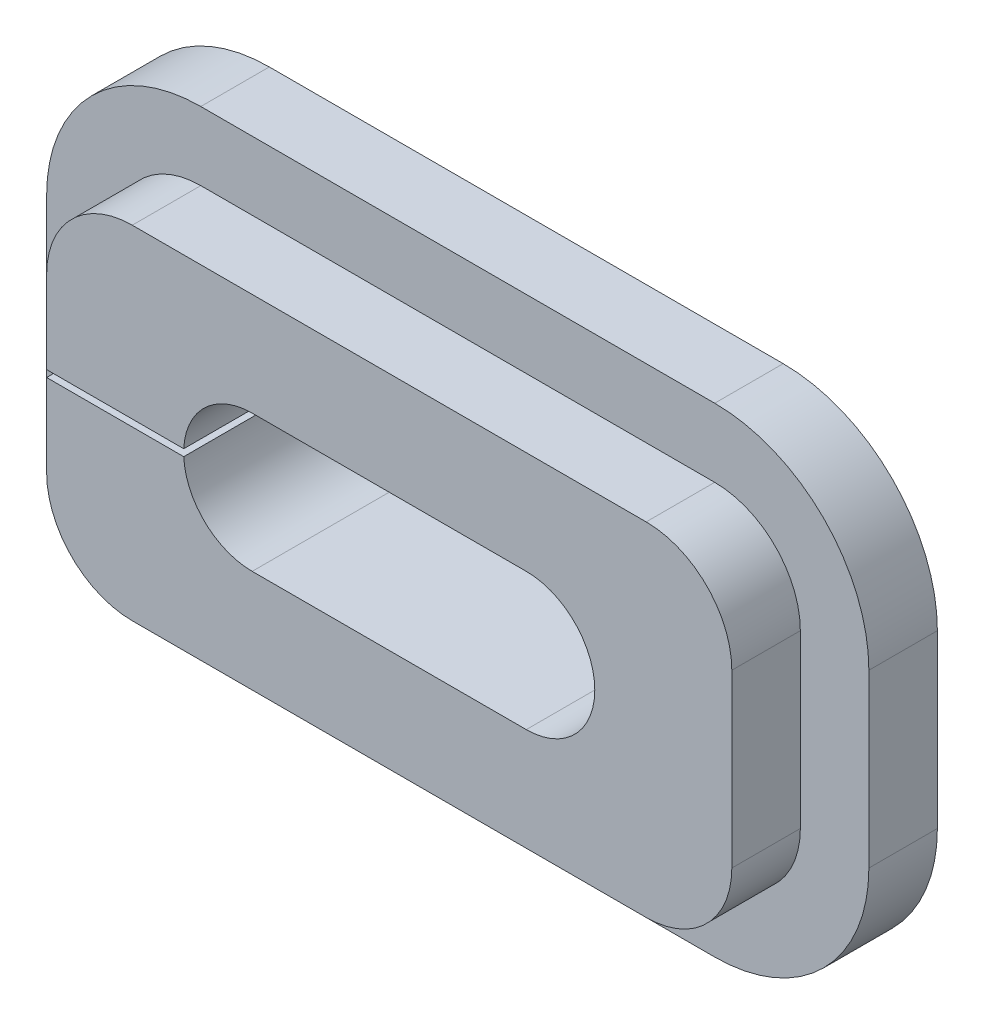
from build123d import *
from build123d.topology import SkipClean

# Parameters (mm, degrees)
SKETCH1_W               = 20
SKETCH1_H               = 10
SKETCH1_W_2             = 12
SKETCH1_H_2             = 4
BOSS_EXTRUDE1_DEPTH     = 2
FILLET1_R               = 2.5
BOSS_EXTRUDE2_DEPTH     = 2
CUT_EXTRUDE1_DEPTH      = 15.035668848
CUT_EXTRUDE1_DEPTH_BACK = 15.035668848
SKETCH3_W               = 8
SKETCH3_H               = 0.2


with BuildPart() as part:
    # Sketch1 → Boss-Extrude1 (new body)
    # profile 1 of 5: a face of its own
    with BuildSketch(Plane.XY):
        Rectangle(SKETCH1_W, SKETCH1_H)
        Rectangle(SKETCH1_W_2, SKETCH1_H_2, mode=Mode.SUBTRACT)
    # profile 2 of 5: a face of its own
    with BuildSketch(Plane.XY):
        with BuildLine():
            ThreePointArc((-6, 0), (-5.414213562, 1.414213562), (-4, 2))
            Line((-4, 2), (-6, 2))
            Line((-6, 2), (-6, 0))
        make_face()
    # profile 3 of 5: a face of its own
    with BuildSketch(Plane.XY):
        with BuildLine():
            ThreePointArc((-4, -2), (-5.414213562, -1.414213562), (-6, 0))
            Line((-6, 0), (-6, -2))
            Line((-6, -2), (-4, -2))
        make_face()
    # profile 4 of 5: a face of its own
    with BuildSketch(Plane.XY):
        with BuildLine():
            Line((6, -2), (6, 0))
            ThreePointArc((6, 0), (5.414213562, -1.414213562), (4, -2))
            Line((4, -2), (6, -2))
        make_face()
    # profile 5 of 5: a face of its own
    with BuildSketch(Plane.XY):
        with BuildLine():
            Line((6, 0), (6, 2))
            Line((6, 2), (4, 2))
            ThreePointArc((4, 2), (5.414213562, 1.414213562), (6, 0))
        make_face()
    extrude(amount=BOSS_EXTRUDE1_DEPTH)

    # Fillet1
    fillet1_edges = [part.edges().sort_by_distance(p)[0] for p in [
        (10, -5, 1),
        (-10, -5, 1),
        (-10, 5, 1),
        (10, 5, 1),
    ]]
    fillet(fillet1_edges, radius=FILLET1_R)

    # Sketch2 → Boss-Extrude2 (add)
    with SkipClean():  # the faces are left unmerged after this step: merging them gives an invalid solid
        with BuildSketch(Plane(origin=(0, 0, 0), x_dir=(-1, 0, 0), z_dir=(0, 0, -1))):
            with BuildLine():
                Line((-3.758342613, 5), (3.758342613, 5))
                ThreePointArc((3.758342613, 5), (5.378679665, 6.468626971), (7.500000019, 7))
                Line((7.500000019, 7), (-7.5, 7))
                ThreePointArc((-7.5, 7), (-5.378679656, 6.468626967), (-3.758342613, 5))
            make_face()
            with BuildLine():
                ThreePointArc((-11.241657387, 0), (-10.681980515, 0.681980515), (-10, 1.241657387))
                Line((-10, 1.241657387), (-10, 2.5))
                ThreePointArc((-10, 2.5), (-9.267766953, 4.267766953), (-7.5, 5))
                Line((-7.5, 5), (-3.758342613, 5))
                ThreePointArc((-3.758342613, 5), (-5.378679656, 6.468626967), (-7.5, 7))
                ThreePointArc((-7.5, 7), (-10.681980515, 5.681980515), (-12, 2.5))
                ThreePointArc((-12, 2.5), (-11.80624304, 1.19375696), (-11.241657387, 0))
            make_face()
            with BuildLine():
                Line((-10, -1.241657387), (-10, 1.241657387))
                ThreePointArc((-10, 1.241657387), (-10.681980515, 0.681980515), (-11.241657387, 0))
                ThreePointArc((-11.241657387, 0), (-10.681980515, -0.681980515), (-10, -1.241657387))
            make_face()
            with BuildLine():
                ThreePointArc((-12, -2.5), (-11.80624304, -1.19375696), (-11.241657387, 0))
                ThreePointArc((-11.241657387, 0), (-11.80624304, 1.19375696), (-12, 2.5))
                Line((-12, 2.5), (-12, -2.5))
            make_face()
            with BuildLine():
                Line((-10, -2.5), (-10, -1.241657387))
                ThreePointArc((-10, -1.241657387), (-10.681980515, -0.681980515), (-11.241657387, 0))
                ThreePointArc((-11.241657387, 0), (-11.80624304, -1.19375696), (-12, -2.5))
                ThreePointArc((-12, -2.5), (-10.681980515, -5.681980515), (-7.5, -7))
                ThreePointArc((-7.5, -7), (-5.378679656, -6.468626967), (-3.758342613, -5))
                Line((-3.758342613, -5), (-7.5, -5))
                ThreePointArc((-7.5, -5), (-9.267766953, -4.267766953), (-10, -2.5))
            make_face()
            with BuildLine():
                ThreePointArc((7.499999979, -7), (5.378679647, -6.468626962), (3.758342613, -5))
                Line((3.758342613, -5), (-3.758342613, -5))
                ThreePointArc((-3.758342613, -5), (-5.378679656, -6.468626967), (-7.5, -7))
                Line((-7.5, -7), (7.499999979, -7))
            make_face()
            with BuildLine():
                Line((7.5, -5), (3.758342613, -5))
                ThreePointArc((3.758342613, -5), (5.378679647, -6.468626962), (7.499999979, -7))
                ThreePointArc((7.499999979, -7), (10.681980508, -5.681980523), (12, -2.5))
                ThreePointArc((12, -2.5), (11.80624304, -1.19375696), (11.241657387, 0))
                ThreePointArc((11.241657387, 0), (10.681980515, -0.681980515), (10, -1.241657387))
                Line((10, -1.241657387), (10, -2.5))
                ThreePointArc((10, -2.5), (9.267766953, -4.267766953), (7.5, -5))
            make_face()
            with BuildLine():
                ThreePointArc((11.241657387, 0), (10.681980515, 0.681980515), (10, 1.241657387))
                Line((10, 1.241657387), (10, -1.241657387))
                ThreePointArc((10, -1.241657387), (10.681980515, -0.681980515), (11.241657387, 0))
            make_face()
            with BuildLine():
                Line((12, -2.5), (12, 2.5))
                ThreePointArc((12, 2.5), (11.80624304, 1.19375696), (11.241657387, 0))
                ThreePointArc((11.241657387, 0), (11.80624304, -1.19375696), (12, -2.5))
            make_face()
            with BuildLine():
                ThreePointArc((7.500000019, 7), (5.378679665, 6.468626971), (3.758342613, 5))
                Line((3.758342613, 5), (7.5, 5))
                ThreePointArc((7.5, 5), (9.267766953, 4.267766953), (10, 2.5))
                Line((10, 2.5), (10, 1.241657387))
                ThreePointArc((10, 1.241657387), (10.681980515, 0.681980515), (11.241657387, 0))
                ThreePointArc((11.241657387, 0), (11.80624304, 1.19375696), (12, 2.5))
                ThreePointArc((12, 2.5), (10.681980522, 5.681980509), (7.500000019, 7))
            make_face()
            with BuildLine():
                ThreePointArc((-5.365330412, 1.461462577), (-4.73385109, 1.860500625), (-4, 2))
                Line((-4, 2), (-3.027864045, 2))
                ThreePointArc((-3.027864045, 2), (-3.006971411, 2.249612098), (-3, 2.5))
                ThreePointArc((-3, 2.5), (-3.19375696, 3.80624304), (-3.758342613, 5))
                Line((-3.758342613, 5), (-7.5, 5))
                ThreePointArc((-7.5, 5), (-9.267766953, 4.267766953), (-10, 2.5))
                Line((-10, 2.5), (-10, 1.241657387))
                ThreePointArc((-10, 1.241657387), (-7.7131787, 1.994947702), (-5.365330412, 1.461462577))
            make_face()
            with BuildLine():
                ThreePointArc((-5.365330412, -1.461462577), (-6, 0), (-5.365330412, 1.461462577))
                ThreePointArc((-5.365330412, 1.461462577), (-7.7131787, 1.994947702), (-10, 1.241657387))
                Line((-10, 1.241657387), (-10, -1.241657387))
                ThreePointArc((-10, -1.241657387), (-7.7131787, -1.994947702), (-5.365330412, -1.461462577))
            make_face()
            with BuildLine():
                ThreePointArc((-4, -2), (-4.73385109, -1.860500625), (-5.365330412, -1.461462577))
                ThreePointArc((-5.365330412, -1.461462577), (-7.7131787, -1.994947702), (-10, -1.241657387))
                Line((-10, -1.241657387), (-10, -2.5))
                ThreePointArc((-10, -2.5), (-9.267766953, -4.267766953), (-7.5, -5))
                Line((-7.5, -5), (-3.758342613, -5))
                ThreePointArc((-3.758342613, -5), (-3.19375696, -3.80624304), (-3, -2.5))
                ThreePointArc((-3, -2.5), (-3.006971411, -2.249612098), (-3.027864045, -2))
                Line((-3.027864045, -2), (-4, -2))
            make_face()
            with BuildLine():
                Line((3.027864045, -2), (-3.027864045, -2))
                ThreePointArc((-3.027864045, -2), (-3.006971411, -2.249612098), (-3, -2.5))
                ThreePointArc((-3, -2.5), (-3.19375696, -3.80624304), (-3.758342613, -5))
                Line((-3.758342613, -5), (3.758342613, -5))
                ThreePointArc((3.758342613, -5), (3.127746546, -3.564612481), (3.027864045, -2))
            make_face()
            with BuildLine():
                Line((4, -2), (3.027864045, -2))
                ThreePointArc((3.027864045, -2), (3.127746546, -3.564612481), (3.758342613, -5))
                Line((3.758342613, -5), (7.5, -5))
                ThreePointArc((7.5, -5), (9.267766953, -4.267766953), (10, -2.5))
                Line((10, -2.5), (10, -1.241657387))
                ThreePointArc((10, -1.241657387), (7.7131787, -1.994947702), (5.365330412, -1.461462577))
                ThreePointArc((5.365330412, -1.461462577), (4.73385109, -1.860500625), (4, -2))
            make_face()
            with BuildLine():
                ThreePointArc((10, 1.241657387), (7.7131787, 1.994947702), (5.365330412, 1.461462577))
                ThreePointArc((5.365330412, 1.461462577), (6, 0), (5.365330412, -1.461462577))
                ThreePointArc((5.365330412, -1.461462577), (7.7131787, -1.994947702), (10, -1.241657387))
                Line((10, -1.241657387), (10, 1.241657387))
            make_face()
            with BuildLine():
                ThreePointArc((3.758342613, 5), (3.127746546, 3.564612481), (3.027864045, 2))
                Line((3.027864045, 2), (4, 2))
                ThreePointArc((4, 2), (4.73385109, 1.860500625), (5.365330412, 1.461462577))
                ThreePointArc((5.365330412, 1.461462577), (7.7131787, 1.994947702), (10, 1.241657387))
                Line((10, 1.241657387), (10, 2.5))
                ThreePointArc((10, 2.5), (9.267766953, 4.267766953), (7.5, 5))
                Line((7.5, 5), (3.758342613, 5))
            make_face()
            with BuildLine():
                ThreePointArc((-3, 2.5), (-3.006971411, 2.249612098), (-3.027864045, 2))
                Line((-3.027864045, 2), (3.027864045, 2))
                ThreePointArc((3.027864045, 2), (3.127746546, 3.564612481), (3.758342613, 5))
                Line((3.758342613, 5), (-3.758342613, 5))
                ThreePointArc((-3.758342613, 5), (-3.19375696, 3.80624304), (-3, 2.5))
            make_face()
        extrude(amount=BOSS_EXTRUDE2_DEPTH)

    # Sketch3 → Cut-Extrude1 (cut, two sides: drawn at the far end of the back side and taken through both)
    with SkipClean():  # the faces are left unmerged after this step: merging them gives an invalid solid
        with BuildSketch(Plane.XY.offset(-CUT_EXTRUDE1_DEPTH_BACK)):
            with Locations((-8, 0)):
                Rectangle(SKETCH3_W, SKETCH3_H)
        extrude(amount=CUT_EXTRUDE1_DEPTH + CUT_EXTRUDE1_DEPTH_BACK, mode=Mode.SUBTRACT)


solid = part.part
